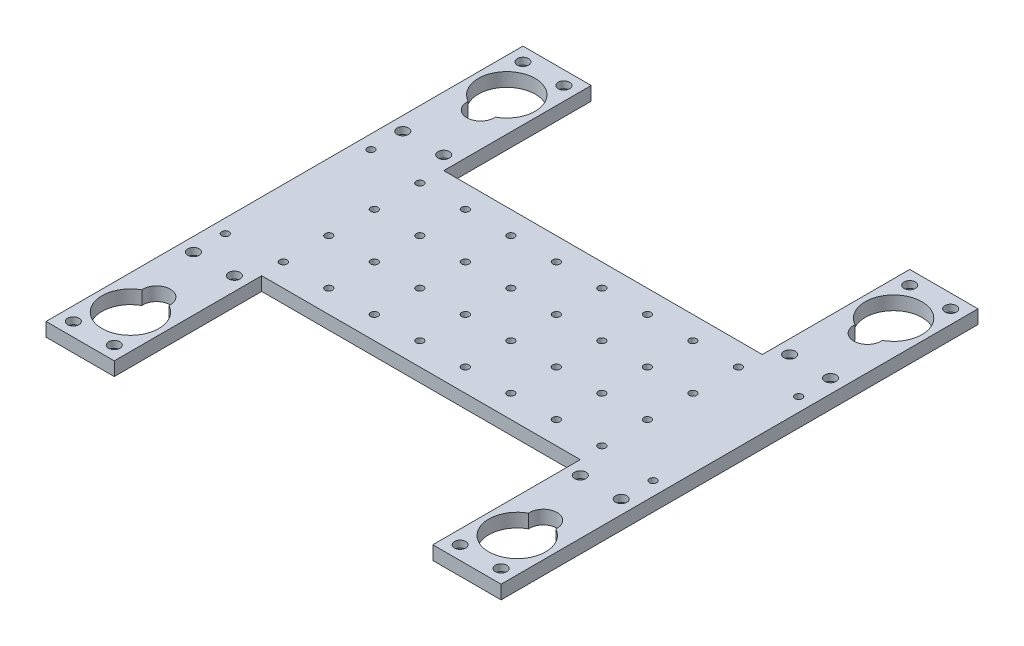
from build123d import *

# Parameters (mm, degrees)
SKETCH_1_W          = 15
SKETCH_1_H          = 32.4
EXTRUDE_1_DEPTH     = 3
SKETCH_2_R          = 6.25
SKETCH_2_R_2        = 1.25
SKETCH_2_R_3        = 3
CUT_EXTRUDE_1_DEPTH = 124.493967464
SKETCH_2_3_R        = 2
CUT_EXTRUDE_2_DEPTH = 1.5
SKETCH_4_R          = 0.8
CUT_EXTRUDE_3_DEPTH = 124.493967464
SKETCH_5_R          = 0.8
CUT_EXTRUDE_4_DEPTH = 3


with BuildPart() as part:
    # 草图1 → 凸台-拉伸1 (new body)
    with BuildSketch(Plane(origin=(0, 0, 0), x_dir=(1, 0, 0), z_dir=(0, 1, 0))):
        with Locations((7.5, 16.2)):
            Rectangle(SKETCH_1_W, SKETCH_1_H)
        Polygon((15, 0), (0, 0), (0, -40), (15, -40), (85, -40), (100, -40), (100, 0), (85, 0), align=None)
        with Locations((7.5, -56.2)):
            Rectangle(SKETCH_1_W, SKETCH_1_H)
        with Locations((92.5, 16.2)):
            Rectangle(SKETCH_1_W, SKETCH_1_H)
        with Locations((92.5, -56.2)):
            Rectangle(SKETCH_1_W, SKETCH_1_H)
    extrude(amount=EXTRUDE_1_DEPTH)

    # 草图2 → 切除-拉伸1 (cut, through all)
    with BuildSketch(Plane.XZ):
        with Locations((7.5, -21.35)):
            Circle(SKETCH_2_R)
        with Locations((3, -3)):
            Circle(SKETCH_2_R_2)
        with Locations((12, -3)):
            Circle(SKETCH_2_R_2)
        with Locations((12, -29.4)):
            Circle(SKETCH_2_R_2)
        with Locations((3, -29.4)):
            Circle(SKETCH_2_R_2)
        with Locations((7.5, -15.6)):
            Circle(SKETCH_2_R_3)
        with Locations((92.5, -21.35)):
            Circle(SKETCH_2_R)
        with Locations((92.5, -15.6)):
            Circle(SKETCH_2_R_3)
        with Locations((88, -3)):
            Circle(SKETCH_2_R_2)
        with Locations((97, -3)):
            Circle(SKETCH_2_R_2)
        with Locations((88, -29.4)):
            Circle(SKETCH_2_R_2)
        with Locations((97, -29.4)):
            Circle(SKETCH_2_R_2)
        with Locations((92.5, 61.35)):
            Circle(SKETCH_2_R)
        with Locations((92.5, 55.6)):
            Circle(SKETCH_2_R_3)
        with Locations((88, 69.4)):
            Circle(SKETCH_2_R_2)
        with Locations((97, 69.4)):
            Circle(SKETCH_2_R_2)
        with Locations((88, 43)):
            Circle(SKETCH_2_R_2)
        with Locations((97, 43)):
            Circle(SKETCH_2_R_2)
        with Locations((3, 69.4)):
            Circle(SKETCH_2_R_2)
        with Locations((12, 69.4)):
            Circle(SKETCH_2_R_2)
        with Locations((7.5, 61.35)):
            Circle(SKETCH_2_R)
        with Locations((7.5, 55.6)):
            Circle(SKETCH_2_R_3)
        with Locations((3, 43)):
            Circle(SKETCH_2_R_2)
        with Locations((12, 43)):
            Circle(SKETCH_2_R_2)
    extrude(amount=-CUT_EXTRUDE_1_DEPTH, mode=Mode.SUBTRACT)

    # 草图2<3> → 切除-拉伸2 (cut)
    with BuildSketch(Plane.XZ):
        with Locations((3, -29.4)):
            Circle(SKETCH_2_3_R)
        with Locations((3, -3)):
            Circle(SKETCH_2_3_R)
        with Locations((12, -3)):
            Circle(SKETCH_2_3_R)
        with Locations((12, -29.4)):
            Circle(SKETCH_2_3_R)
        with Locations((88, -3)):
            Circle(SKETCH_2_3_R)
        with Locations((97, -3)):
            Circle(SKETCH_2_3_R)
        with Locations((88, -29.4)):
            Circle(SKETCH_2_3_R)
        with Locations((97, -29.4)):
            Circle(SKETCH_2_3_R)
        with Locations((88, 69.4)):
            Circle(SKETCH_2_3_R)
        with Locations((97, 69.4)):
            Circle(SKETCH_2_3_R)
        with Locations((88, 43)):
            Circle(SKETCH_2_3_R)
        with Locations((97, 43)):
            Circle(SKETCH_2_3_R)
        with Locations((3, 69.4)):
            Circle(SKETCH_2_3_R)
        with Locations((12, 69.4)):
            Circle(SKETCH_2_3_R)
        with Locations((3, 43)):
            Circle(SKETCH_2_3_R)
        with Locations((12, 43)):
            Circle(SKETCH_2_3_R)
    extrude(amount=-CUT_EXTRUDE_2_DEPTH, mode=Mode.SUBTRACT)

    # 草图4 → 切除-拉伸3 (cut, through all)
    with BuildSketch(Plane(origin=(0, 3, 0), x_dir=(1, 0, 0), z_dir=(0, 1, 0))):
        with Locations((3, -4)):
            Circle(SKETCH_4_R)
        with Locations((3, -36)):
            Circle(SKETCH_4_R)
        with Locations((97, -36)):
            Circle(SKETCH_4_R)
        with Locations((97, -4)):
            Circle(SKETCH_4_R)
    extrude(amount=-CUT_EXTRUDE_3_DEPTH, mode=Mode.SUBTRACT)

    # 草图5 → 切除-拉伸4 (cut)
    with BuildSketch(Plane(origin=(0, 3, 0), x_dir=(1, 0, 0), z_dir=(0, 1, 0))):
        with Locations((14.75, -5)):
            Circle(SKETCH_5_R)
        with Locations((24.75, -5)):
            Circle(SKETCH_5_R)
        with Locations((34.75, -5)):
            Circle(SKETCH_5_R)
        with Locations((44.75, -5)):
            Circle(SKETCH_5_R)
        with Locations((54.75, -5)):
            Circle(SKETCH_5_R)
        with Locations((64.75, -5)):
            Circle(SKETCH_5_R)
        with Locations((74.75, -5)):
            Circle(SKETCH_5_R)
        with Locations((84.75, -5)):
            Circle(SKETCH_5_R)
        with Locations((24.75, -15)):
            Circle(SKETCH_5_R)
        with Locations((34.75, -15)):
            Circle(SKETCH_5_R)
        with Locations((44.75, -15)):
            Circle(SKETCH_5_R)
        with Locations((54.75, -15)):
            Circle(SKETCH_5_R)
        with Locations((64.75, -15)):
            Circle(SKETCH_5_R)
        with Locations((74.75, -15)):
            Circle(SKETCH_5_R)
        with Locations((84.75, -15)):
            Circle(SKETCH_5_R)
        with Locations((24.75, -25)):
            Circle(SKETCH_5_R)
        with Locations((34.75, -25)):
            Circle(SKETCH_5_R)
        with Locations((44.75, -25)):
            Circle(SKETCH_5_R)
        with Locations((54.75, -25)):
            Circle(SKETCH_5_R)
        with Locations((64.75, -25)):
            Circle(SKETCH_5_R)
        with Locations((74.75, -25)):
            Circle(SKETCH_5_R)
        with Locations((84.75, -25)):
            Circle(SKETCH_5_R)
        with Locations((24.75, -35)):
            Circle(SKETCH_5_R)
        with Locations((34.75, -35)):
            Circle(SKETCH_5_R)
        with Locations((44.75, -35)):
            Circle(SKETCH_5_R)
        with Locations((54.75, -35)):
            Circle(SKETCH_5_R)
        with Locations((64.75, -35)):
            Circle(SKETCH_5_R)
        with Locations((74.75, -35)):
            Circle(SKETCH_5_R)
        with Locations((84.75, -35)):
            Circle(SKETCH_5_R)
        with Locations((14.75, -15)):
            Circle(SKETCH_5_R)
        with Locations((14.75, -25)):
            Circle(SKETCH_5_R)
        with Locations((14.75, -35)):
            Circle(SKETCH_5_R)
    extrude(amount=-CUT_EXTRUDE_4_DEPTH, mode=Mode.SUBTRACT)


solid = part.part
